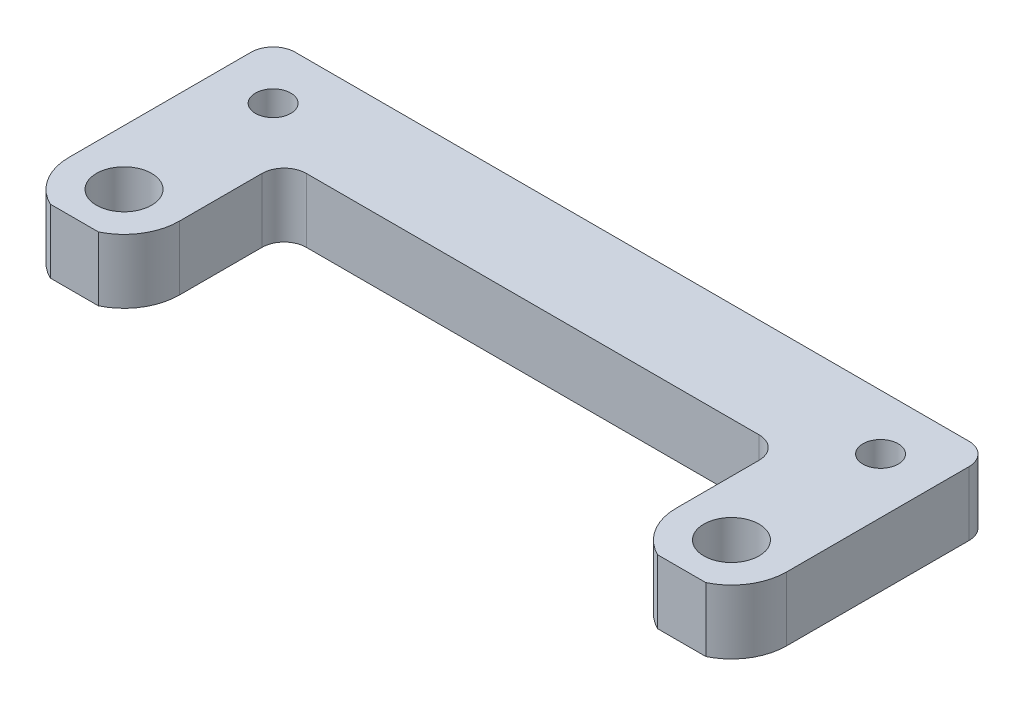
from build123d import *

# Parameters (mm, degrees)
SKETCH_1_R      = 2.5
SKETCH_1_R_2    = 1.6
EXTRUDE_1_DEPTH = 5.8
FILLET_1_R      = 2


with BuildPart() as part:
    # ｽｹｯﾁ1 → ﾎﾞｽ - 押し出し1 (new body)
    with BuildSketch(Plane(origin=(0, 0, 0), x_dir=(1, 0, 0), z_dir=(0, 1, 0))):
        with BuildLine():
            ThreePointArc((29.679449472, -18), (31.736581603, -16.155442773), (32.5, -13.5))
            Line((32.5, -13.5), (32.5, -5))
            Line((32.5, -5), (32.5, 5))
            Line((32.5, 5), (-32.5, 5))
            Line((-32.5, 5), (-32.5, -5))
            Line((-32.5, -5), (-32.5, -13.5))
            ThreePointArc((-32.5, -13.5), (-31.736581603, -16.155442773), (-29.679449472, -18))
            Line((-29.679449472, -18), (-25.320550528, -18))
            ThreePointArc((-25.320550528, -18), (-23.263418397, -16.155442773), (-22.5, -13.5))
            Line((-22.5, -13.5), (-22.5, -4))
            Line((-22.5, -4), (22.5, -4))
            Line((22.5, -4), (22.5, -13.5))
            ThreePointArc((22.5, -13.5), (23.263418397, -16.155442773), (25.320550528, -18))
            Line((25.320550528, -18), (29.679449472, -18))
        make_face()
        with Locations(Location((-27.5, -13.5, 0), (0, 0, 270))):
            Circle(SKETCH_1_R, mode=Mode.SUBTRACT)
        with Locations(Location((27.5, -13.5, 0), (0, 0, 270))):
            Circle(SKETCH_1_R, mode=Mode.SUBTRACT)
        with Locations(Location((-27.5, 0, 0), (0, 0, 270))):
            Circle(SKETCH_1_R_2, mode=Mode.SUBTRACT)
        with Locations(Location((27.5, 0, 0), (0, 0, 270))):
            Circle(SKETCH_1_R_2, mode=Mode.SUBTRACT)
    extrude(amount=EXTRUDE_1_DEPTH)

    # ﾌｨﾚｯﾄ1
    fillet_1_edges = [part.edges().sort_by_distance(p)[0] for p in [
        (-32.5, 2.9, -5),
        (32.5, 2.9, -5),
        (22.5, 2.9, 4),
        (-22.5, 2.9, 4),
    ]]
    fillet(fillet_1_edges, radius=FILLET_1_R)


solid = part.part
